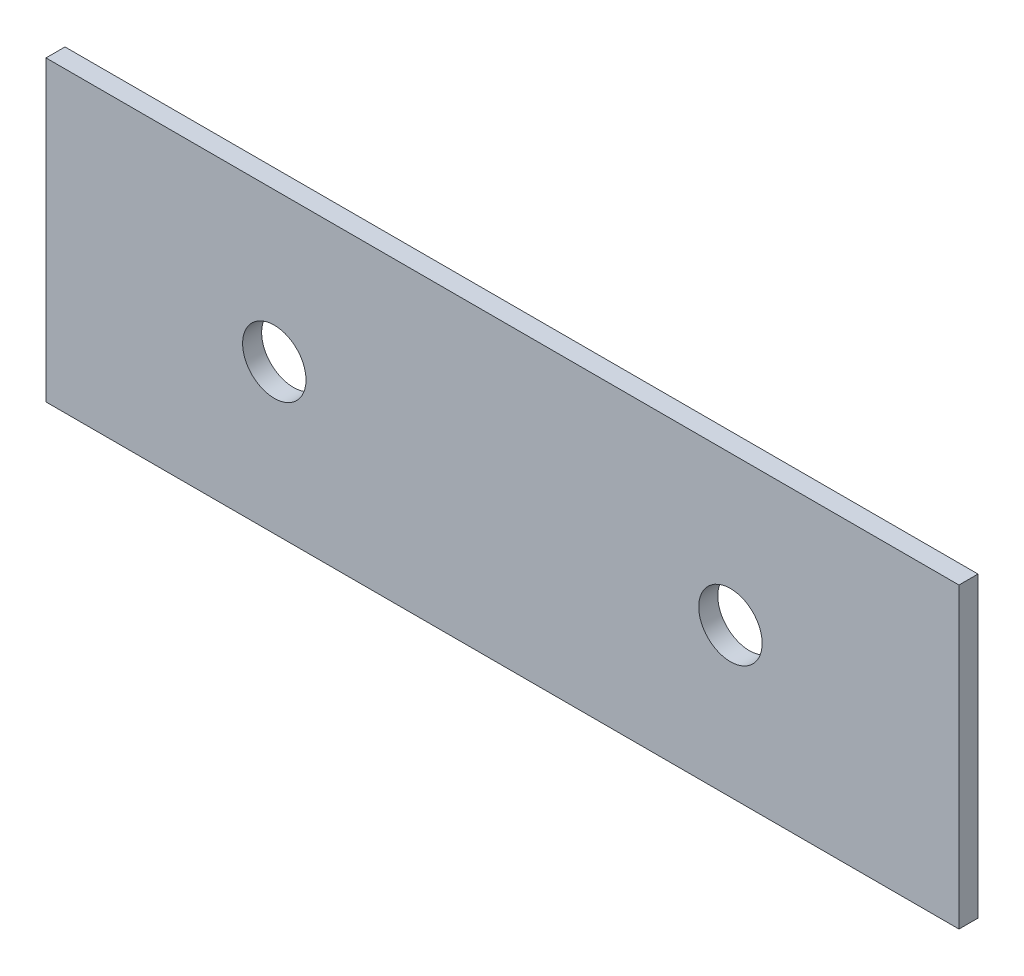
from build123d import *

# Parameters (mm, degrees)
SKETCH1_W           = 144
SKETCH1_H           = 47
BOSS_EXTRUDE1_DEPTH = 3
CUT_EXTRUDE2_DEPTH  = 10


with BuildPart() as part:
    # Sketch1 → Boss-Extrude1 (new body)
    with BuildSketch(Plane.XY):
        with Locations((87.644313661, 219.681377026)):
            Rectangle(SKETCH1_W, SKETCH1_H)
    extrude(amount=BOSS_EXTRUDE1_DEPTH)

    # Sketch5 → Cut-Extrude2 (cut)
    with BuildSketch(Plane.XY.offset(3)):
        with BuildLine():
            ThreePointArc((56.652582595, 219.681377026), (51.652582595, 224.681377026), (46.652582595, 219.681377026))
            Line((46.652582595, 219.681377026), (56.652582595, 219.681377026))
        make_face()
        with BuildLine():
            Line((56.652582595, 219.681377026), (46.652582595, 219.681377026))
            ThreePointArc((46.652582595, 219.681377026), (51.652582595, 214.681377026), (56.652582595, 219.681377026))
        make_face()
        with BuildLine():
            ThreePointArc((128.597865768, 219.681377026), (123.597865768, 224.681377026), (118.597865768, 219.681377026))
            Line((118.597865768, 219.681377026), (128.597865768, 219.681377026))
        make_face()
        with BuildLine():
            Line((128.597865768, 219.681377026), (118.597865768, 219.681377026))
            ThreePointArc((118.597865768, 219.681377026), (123.597865768, 214.681377026), (128.597865768, 219.681377026))
        make_face()
    extrude(amount=-CUT_EXTRUDE2_DEPTH, mode=Mode.SUBTRACT)


solid = part.part
